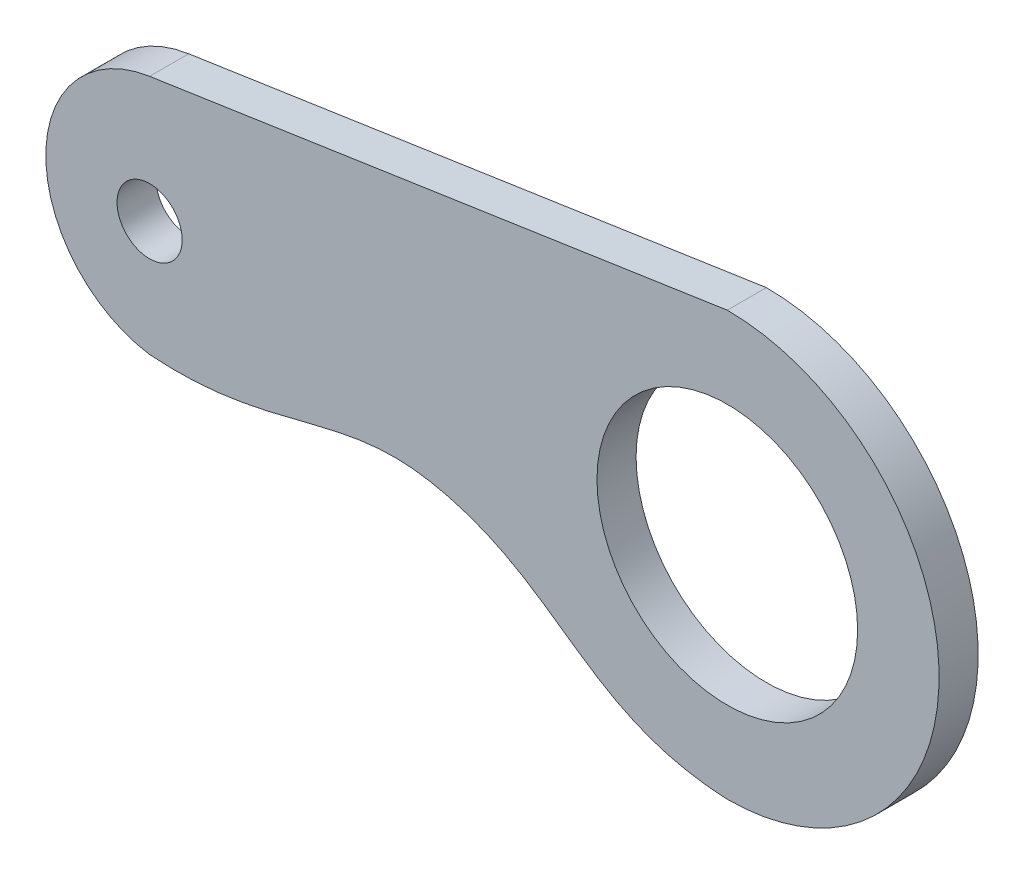
from build123d import *

# Parameters (mm, degrees)
SKETCH_1_R      = 20
SKETCH_1_R_2    = 5
EXTRUDE_1_DEPTH = 6


with BuildPart() as part:
    # Эскиз1 → Вытянуть1 (new body)
    with BuildSketch(Plane.XY):
        with BuildLine():
            Line((-88.652848771, 19.249029144), (0, 32.5))
            ThreePointArc((0, 32.5), (32.5, 0), (0, -32.5))
            add(Edge.make_bspline(
                [(-88.652848771, -17.726099374), (-70.912657014, -19.048471367), (-58.669056624, -9.575263386), (-25.513197615, -17.946964386), (-19.385232924, -31.623438469), (0, -32.5)],
                knots=[0, 0, 0, 0, 0.412174962, 0.512174962, 1, 1, 1, 1], degree=3))
            ThreePointArc((-88.652848771, -17.726099374), (-104.582448721, 0.761464885), (-88.652848771, 19.249029144))
        make_face()
        Circle(SKETCH_1_R, mode=Mode.SUBTRACT)
        with Locations((-88.652848771, 0)):
            Circle(SKETCH_1_R_2, mode=Mode.SUBTRACT)
    extrude(amount=EXTRUDE_1_DEPTH)


solid = part.part
